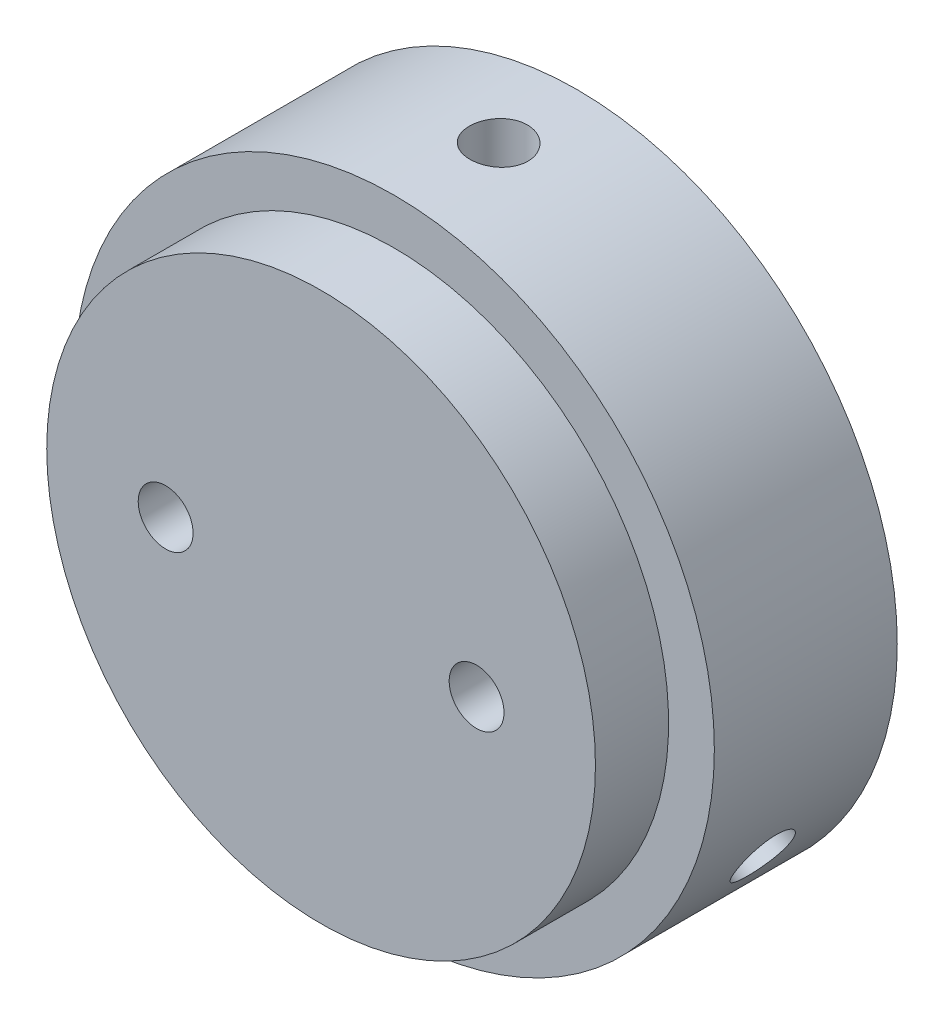
from build123d import *
from build123d.topology import SkipClean

# Parameters (mm, degrees)
SKETCH1_R               = 15
SKETCH1_R_2             = 1.5
BOSS_EXTRUDE1_DEPTH     = 4
BOSS_EXTRUDE2_START     = 10
SKETCH4_R               = 17.5
SKETCH4_R_2             = 2.5
SKETCH4_R_3             = 1.5
BOSS_EXTRUDE2_DEPTH     = 10
SKETCH12_W              = 5.5
SKETCH12_H              = 2.5
CUT_EXTRUDE7_DEPTH      = 10
CUT_EXTRUDE8_DEPTH      = 15
CUT_EXTRUDE8_DEPTH_BACK = 2
SKETCH17_R              = 1.6
CUT_EXTRUDE9_DEPTH      = 30
CUT_EXTRUDE9_DEPTH_BACK = 2
ESBO_O2_R               = 1.6
CORTE_EXTRUS_O1_DEPTH   = 15


with BuildPart() as part:
    # Sketch1 → Boss-Extrude1 (new body)
    with BuildSketch(Plane.XY):
        Circle(SKETCH1_R)
        with Locations((-8.5, 0)):
            Circle(SKETCH1_R_2, mode=Mode.SUBTRACT)
        with Locations((8.5, 0)):
            Circle(SKETCH1_R_2, mode=Mode.SUBTRACT)
    extrude(amount=BOSS_EXTRUDE1_DEPTH)

    # Sketch4 → Boss-Extrude2 (add)
    with SkipClean():  # the faces are left unmerged after this step: merging them gives an invalid solid
        with BuildSketch(Plane(origin=(0, 0, 0), x_dir=(-1, 0, 0), z_dir=(0, 0, -1)).offset(BOSS_EXTRUDE2_START)):
            Circle(SKETCH4_R)
            with Locations((0, 0.5)):
                Circle(SKETCH4_R_2, mode=Mode.SUBTRACT)
            with Locations((8.5, 0)):
                Circle(SKETCH4_R_3, mode=Mode.SUBTRACT)
            with Locations((-8.5, 0)):
                Circle(SKETCH4_R_3, mode=Mode.SUBTRACT)
        extrude(amount=-BOSS_EXTRUDE2_DEPTH)

    # Sketch12 → Cut-Extrude7 (cut)
    with SkipClean():  # the faces are left unmerged after this step: merging them gives an invalid solid
        with BuildSketch(Plane(origin=(0, 0, -10), x_dir=(-1, 0, 0), z_dir=(0, 0, -1))):
            Polygon((1.098076211, -4.098076211), (4.098076211, 1.098076211), (6.479646072, -0.276923789), (3.479646072, -5.473076211), align=None)
            with Locations((0, 3.25)):
                Rectangle(SKETCH12_W, SKETCH12_H)
            Polygon((-3.479646072, -5.473076211), (-1.098076211, -4.098076211), (-4.098076211, 1.098076211), (-6.479646072, -0.276923789), align=None)
        extrude(amount=-CUT_EXTRUDE7_DEPTH, mode=Mode.SUBTRACT)

    # Sketch17 → Cut-Extrude8 (cut, two sides: drawn at the far end of the back side and taken through both)
    with SkipClean():  # the faces are left unmerged after this step: merging them gives an invalid solid
        with BuildSketch(Plane(origin=(2.598076211, -1.5, 0), x_dir=(0, 0, -1), z_dir=(0.8660254037844387, -0.4999999999999998, 0)).offset(-CUT_EXTRUDE8_DEPTH_BACK)):
            with Locations((5, 0)):
                Circle(SKETCH17_R)
        extrude(amount=CUT_EXTRUDE8_DEPTH + CUT_EXTRUDE8_DEPTH_BACK, mode=Mode.SUBTRACT)

    # Sketch18 → Cut-Extrude9 (cut, two sides: drawn at the far end of the back side and taken through both)
    with SkipClean():  # the faces are left unmerged after this step: merging them gives an invalid solid
        with BuildSketch(Plane(origin=(-2.598076211, -1.5, 0), x_dir=(0, 0, 1), z_dir=(-0.8660254037844387, -0.4999999999999998, 0)).offset(-CUT_EXTRUDE9_DEPTH_BACK)):
            with BuildLine():
                ThreePointArc((-6.6, 0), (-5, -1.6), (-3.4, 0))
                ThreePointArc((-3.4, 0), (-5, 1.6), (-6.6, 0))
            make_face()
        extrude(amount=CUT_EXTRUDE9_DEPTH + CUT_EXTRUDE9_DEPTH_BACK, mode=Mode.SUBTRACT)

    # Esboço2 → Corte-extrusão1 (cut)
    with SkipClean():  # the faces are left unmerged after this step: merging them gives an invalid solid
        with BuildSketch(Plane.XZ.offset(-4.5)):
            with Locations((0.337764543, -5.369510029)):
                Circle(ESBO_O2_R)
        extrude(amount=-CORTE_EXTRUS_O1_DEPTH, mode=Mode.SUBTRACT)


solid = part.part
